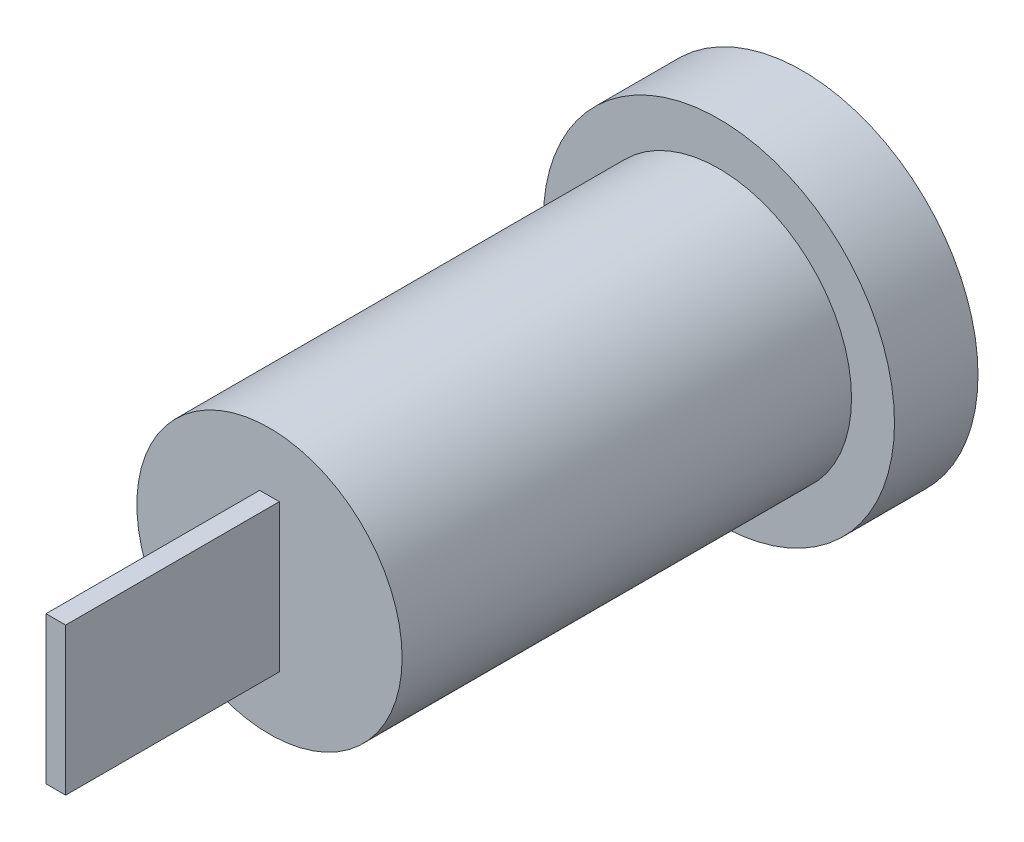
from build123d import *

# Parameters (mm, degrees)
ESQUISSE1_R             = 5.4
BOSS_EXTRU_1_DEPTH      = 18.3
ESQUISSE2_R             = 7.15
BOSS_EXTRU_3_DEPTH      = 3.4
ESQUISSE3_R             = 4.15
ESQUISSE3_R_2           = 3
ENL_V_MAT_EXTRU_1_DEPTH = 3.4
ESQUISSE5_R             = 2
ENL_V_MAT_EXTRU_2_DEPTH = 3.4
ESQUISSE6_W             = 0.8
ESQUISSE6_H             = 6
BOSS_EXTRU_4_DEPTH      = 8.7


with BuildPart() as part:
    # Esquisse1 → Boss.-Extru.1 (new body)
    with BuildSketch(Plane.XY):
        Circle(ESQUISSE1_R)
    extrude(amount=BOSS_EXTRU_1_DEPTH)

    # Esquisse2 → Boss.-Extru.3 (add)
    with BuildSketch(Plane(origin=(0, 0, 0), x_dir=(-1, 0, 0), z_dir=(0, 0, -1))):
        Circle(ESQUISSE2_R)
    extrude(amount=BOSS_EXTRU_3_DEPTH)

    # Esquisse3 → Enlèv. mat.-Extru.1 (cut)
    with BuildSketch(Plane(origin=(0, 0, -3.4), x_dir=(-1, 0, 0), z_dir=(0, 0, -1))):
        Circle(ESQUISSE3_R)
        Circle(ESQUISSE3_R_2, mode=Mode.SUBTRACT)
    extrude(amount=-ENL_V_MAT_EXTRU_1_DEPTH, mode=Mode.SUBTRACT)

    # Esquisse5 → Enlèv. mat.-Extru.2 (cut)
    with BuildSketch(Plane(origin=(0, 0, -3.4), x_dir=(-1, 0, 0), z_dir=(0, 0, -1))):
        Circle(ESQUISSE5_R)
    extrude(amount=-ENL_V_MAT_EXTRU_2_DEPTH, mode=Mode.SUBTRACT)

    # Esquisse6 → Boss.-Extru.4 (add)
    with BuildSketch(Plane.XY.offset(18.3)):
        Rectangle(ESQUISSE6_W, ESQUISSE6_H)
    extrude(amount=BOSS_EXTRU_4_DEPTH)


solid = part.part
